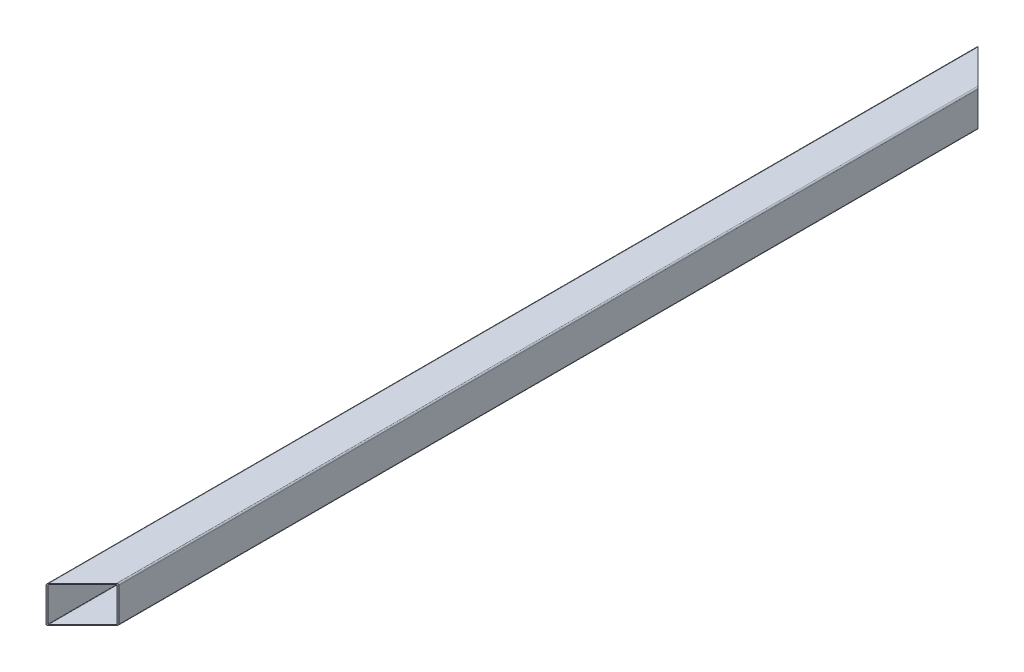
from build123d import *

# Parameters (mm, degrees)
STRUCTURAL_MEMBER1_DEPTH = 1020
CUT_EXTRUDE4_DEPTH       = 120


with BuildPart() as part:
    # Sketch12 → Structural Member1 (new body)
    with BuildSketch(Plane(origin=(0, 0, 0), x_dir=(-1, 0, 0), z_dir=(0, 0, -1))):
        with BuildLine():
            Line((-18.5, -20), (18.5, -20))
            ThreePointArc((18.5, -20), (19.560660172, -19.560660172), (20, -18.5))
            Line((20, -18.5), (20, 18.5))
            ThreePointArc((20, 18.5), (19.560660172, 19.560660172), (18.5, 20))
            Line((18.5, 20), (-18.5, 20))
            ThreePointArc((-18.5, 20), (-19.560660172, 19.560660172), (-20, 18.5))
            Line((-20, 18.5), (-20, -18.5))
            ThreePointArc((-20, -18.5), (-19.560660172, -19.560660172), (-18.5, -20))
        make_face()
        with BuildLine():
            Line((-18.5, -18.8), (18.5, -18.8))
            ThreePointArc((18.5, -18.8), (18.712132034, -18.712132034), (18.8, -18.5))
            Line((18.8, -18.5), (18.8, 18.5))
            ThreePointArc((18.8, 18.5), (18.712132034, 18.712132034), (18.5, 18.8))
            Line((18.5, 18.8), (-18.5, 18.8))
            ThreePointArc((-18.5, 18.8), (-18.712132034, 18.712132034), (-18.8, 18.5))
            Line((-18.8, 18.5), (-18.8, -18.5))
            ThreePointArc((-18.8, -18.5), (-18.712132034, -18.712132034), (-18.5, -18.8))
        make_face(mode=Mode.SUBTRACT)
    extrude(amount=STRUCTURAL_MEMBER1_DEPTH)

    # Sketch18 → Cut-Extrude4 (cut)
    with BuildSketch(Plane(origin=(0, 50, 0), x_dir=(1, 0, 0), z_dir=(0, 1, 0))):
        Polygon((-20, 1020), (31.2450691, 968.7549309), (31.2450691, 1020), align=None)
        Polygon((-20, 0), (27.845949313, 47.845949313), (27.845949313, 0), align=None)
    extrude(amount=-CUT_EXTRUDE4_DEPTH, mode=Mode.SUBTRACT)


solid = part.part
